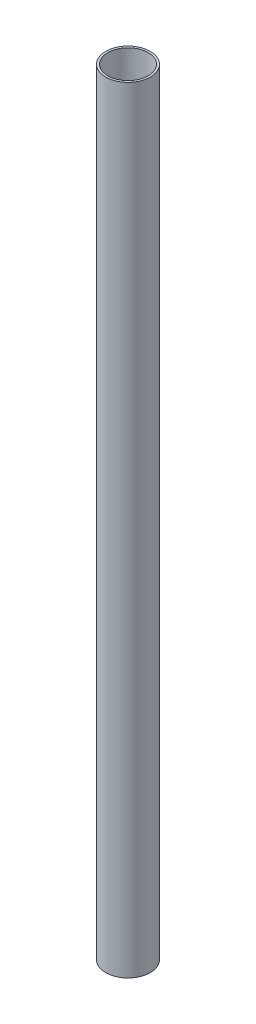
from build123d import *

# Parameters (mm, degrees)
SKETCH1_R           = 15.875
SKETCH1_R_2         = 14.351
BOSS_EXTRUDE1_DEPTH = 552.45


with BuildPart() as part:
    # Sketch1 → Boss-Extrude1 (new body)
    with BuildSketch(Plane(origin=(0, 0, 0), x_dir=(1, 0, 0), z_dir=(0, 1, 0))):
        with Locations(Location((0, 0, 0), (0, 0, 270))):
            Circle(SKETCH1_R)
        with Locations(Location((0, 0, 0), (0, 0, 270))):
            Circle(SKETCH1_R_2, mode=Mode.SUBTRACT)
    extrude(amount=BOSS_EXTRUDE1_DEPTH)


solid = part.part
